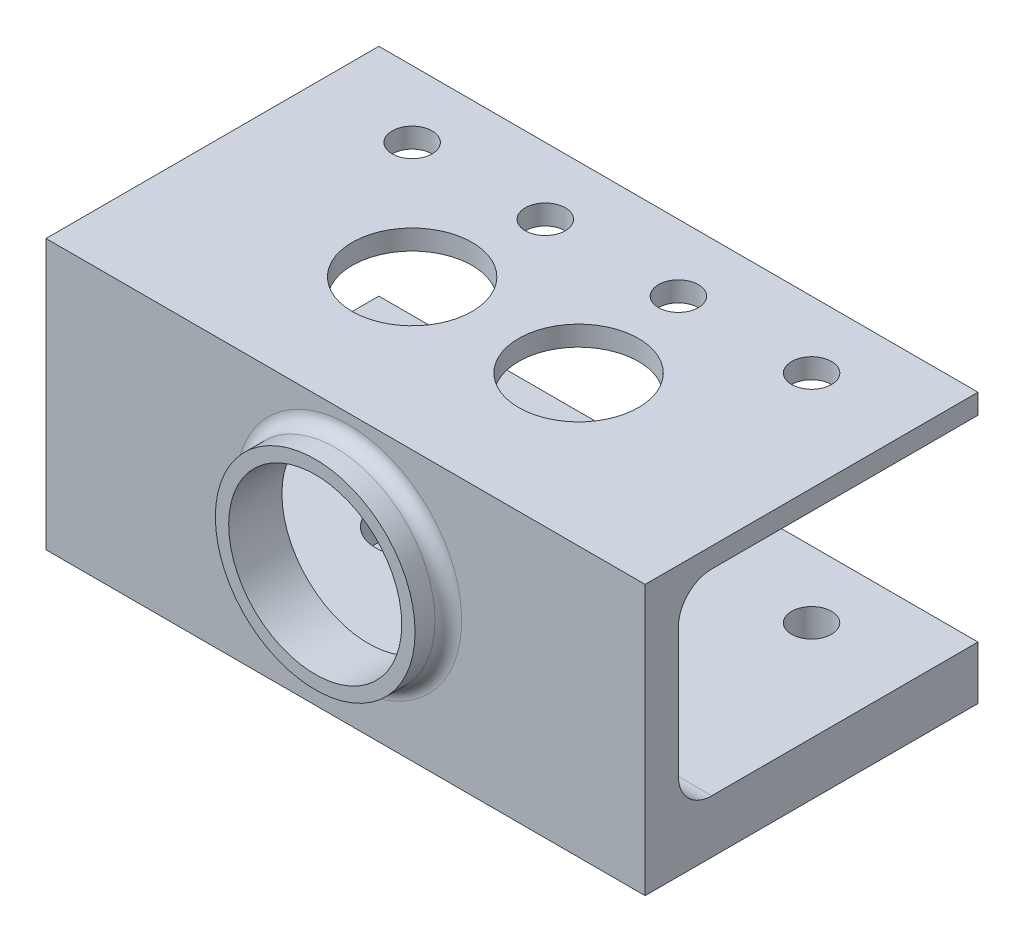
from build123d import *

# Parameters (mm, degrees)
SKETCH2_W               = 90
SKETCH2_H               = 45
BOSS_EXTRUDE1_DEPTH     = 8
SKETCH3_R               = 3.25
CUT_EXTRUDE1_DEPTH      = 10
SKETCH5_R               = 5.5
CUT_EXTRUDE2_DEPTH      = 5
SKETCH6_W               = 90
SKETCH6_H               = 5
BOSS_EXTRUDE2_DEPTH     = 32.5
SKETCH7_W               = 90
SKETCH7_H               = 3
BOSS_EXTRUDE3_DEPTH     = 45
SKETCH8_R               = 13
CUT_EXTRUDE4_DEPTH      = 13
BOSS_EXTRUDE6_START     = 5
SKETCH11_R              = 15
SKETCH11_R_2            = 13
BOSS_EXTRUDE6_DEPTH     = 5
FILLET1_R               = 2
CUT_EXTRUDE5_START      = -2
SKETCH12_R              = 13
CUT_EXTRUDE5_DEPTH      = 2
CUT_EXTRUDE6_DEPTH      = 67.494360663
CUT_EXTRUDE6_DEPTH_BACK = 67.494360663
SKETCH13_R              = 3
SKETCH14_R              = 9
CUT_EXTRUDE7_DEPTH      = 12
SKETCH16_W              = 90
SKETCH16_H              = 8
BOSS_EXTRUDE7_DEPTH     = 5
FILLET2_R               = 5


with BuildPart() as part:
    # Sketch2 → Boss-Extrude1 (new body)
    with BuildSketch(Plane(origin=(0, 0, 0), x_dir=(1, 0, 0), z_dir=(0, 1, 0))):
        Rectangle(SKETCH2_W, SKETCH2_H)
    extrude(amount=BOSS_EXTRUDE1_DEPTH)

    # Sketch3 → Cut-Extrude1 (cut)
    with BuildSketch(Plane(origin=(0, 8, 0), x_dir=(1, 0, 0), z_dir=(0, 1, 0))):
        with Locations(Location((12.5, 0, 0), (0, 0, 270))):
            Circle(SKETCH3_R)
        with Locations(Location((-12.5, 0, 0), (0, 0, 270))):
            Circle(SKETCH3_R)
    extrude(amount=-CUT_EXTRUDE1_DEPTH, mode=Mode.SUBTRACT)

    # Sketch5 → Cut-Extrude2 (cut)
    with BuildSketch(Plane(origin=(0, 8, 0), x_dir=(1, 0, 0), z_dir=(0, 1, 0))):
        with Locations(Location((-12.5, 0, 0), (0, 0, 270))):
            Circle(SKETCH5_R)
        with Locations(Location((12.5, 0, 0), (0, 0, 270))):
            Circle(SKETCH5_R)
    extrude(amount=-CUT_EXTRUDE2_DEPTH, mode=Mode.SUBTRACT)

    # Sketch6 → Boss-Extrude2 (add)
    with BuildSketch(Plane(origin=(0, 8, 0), x_dir=(1, 0, 0), z_dir=(0, 1, 0))):
        with Locations((0, -20)):
            Rectangle(SKETCH6_W, SKETCH6_H)
    extrude(amount=BOSS_EXTRUDE2_DEPTH)

    # Sketch7 → Boss-Extrude3 (add)
    with BuildSketch(Plane(origin=(0, 0, 17.5), x_dir=(-1, 0, 0), z_dir=(0, 0, -1))):
        with Locations((0, 39)):
            Rectangle(SKETCH7_W, SKETCH7_H)
    extrude(amount=BOSS_EXTRUDE3_DEPTH)

    # Sketch8 → Cut-Extrude4 (cut)
    with BuildSketch(Plane.XY.offset(22.5)):
        with Locations((0.439882225, 22.012295082)):
            Circle(SKETCH8_R)
    extrude(amount=-CUT_EXTRUDE4_DEPTH, mode=Mode.SUBTRACT)

    # Sketch11 → Boss-Extrude6 (add)
    with BuildSketch(Plane.XY.offset(22.5).offset(BOSS_EXTRUDE6_START)):
        with Locations(Location((0.439882225, 22.012295082, 0), (0, 0, 180))):
            Circle(SKETCH11_R)
        with Locations((0.439882225, 22.012295082)):
            Circle(SKETCH11_R_2, mode=Mode.SUBTRACT)
    extrude(amount=-BOSS_EXTRUDE6_DEPTH)

    # Fillet1
    fillet1_edges = [part.edges().sort_by_distance(p)[0] for p in [
        (15.439882225, 22.012295082, 22.5),
    ]]
    fillet(fillet1_edges, radius=FILLET1_R)

    # Sketch12 → Cut-Extrude5 (cut)
    with BuildSketch(Plane(origin=(0, 0, 17.5), x_dir=(-1, 0, 0), z_dir=(0, 0, -1)).offset(CUT_EXTRUDE5_START)):
        with BuildLine():
            Line((-28.100883588, 8), (27.221119137, 8))
            ThreePointArc((27.221119137, 8), (30.795754245, 22.781960072), (26.966438327, 37.5))
            Line((26.966438327, 37.5), (-27.846202777, 37.5))
            ThreePointArc((-27.846202777, 37.5), (-31.675518695, 22.781960072), (-28.100883588, 8))
        make_face()
        with Locations(Location((-0.439882225, 22.012295082, 0), (0, 0, 180))):
            Circle(SKETCH12_R, mode=Mode.SUBTRACT)
    extrude(amount=CUT_EXTRUDE5_DEPTH, mode=Mode.SUBTRACT)

    # Sketch13 → Cut-Extrude6 (cut, two sides: drawn at the far end of the back side and taken through both)
    with BuildSketch(Plane(origin=(0, 40.5, 0), x_dir=(1, 0, 0), z_dir=(0, 1, 0)).offset(-CUT_EXTRUDE6_DEPTH_BACK)):
        with Locations(Location((-30, 17.5, 0), (0, 0, 270))):
            Circle(SKETCH13_R)
        with Locations(Location((-10, 17.5, 0), (0, 0, 270))):
            Circle(SKETCH13_R)
        with Locations(Location((10, 17.5, 0), (0, 0, 270))):
            Circle(SKETCH13_R)
        with Locations(Location((30, 17.5, 0), (0, 0, 270))):
            Circle(SKETCH13_R)
    extrude(amount=CUT_EXTRUDE6_DEPTH + CUT_EXTRUDE6_DEPTH_BACK, mode=Mode.SUBTRACT)

    # Sketch14 → Cut-Extrude7 (cut)
    with BuildSketch(Plane(origin=(0, 40.5, 0), x_dir=(1, 0, 0), z_dir=(0, 1, 0))):
        with Locations(Location((-12.5, 0, 0), (0, 0, 270))):
            Circle(SKETCH14_R)
        with Locations(Location((12.5, 0, 0), (0, 0, 270))):
            Circle(SKETCH14_R)
    extrude(amount=-CUT_EXTRUDE7_DEPTH, mode=Mode.SUBTRACT)

    # Sketch16 → Boss-Extrude7 (add)
    with BuildSketch(Plane(origin=(0, 0, -22.5), x_dir=(-1, 0, 0), z_dir=(0, 0, -1))):
        with Locations((0, 4)):
            Rectangle(SKETCH16_W, SKETCH16_H)
    extrude(amount=BOSS_EXTRUDE7_DEPTH)

    # Fillet2
    fillet2_edges = [part.edges().sort_by_distance(p)[0] for p in [
        (36.550441794, 8, 17.5),
        (36.423101389, 37.5, 17.5),
        (-35.983219164, 37.5, 17.5),
        (-36.110559569, 8, 17.5),
    ]]
    fillet(fillet2_edges, radius=FILLET2_R)


solid = part.part
